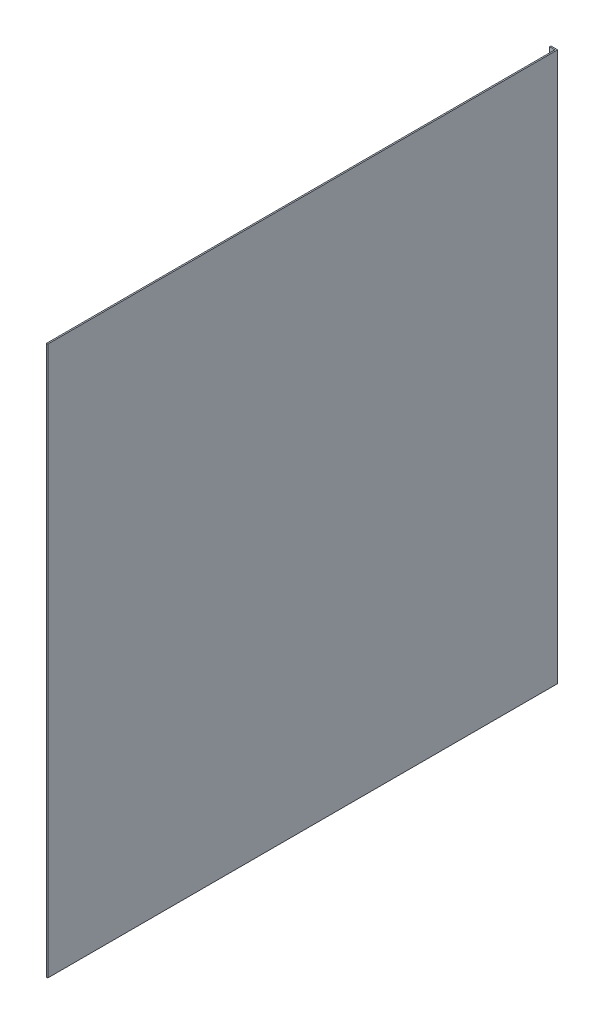
from build123d import *

# Parameters (mm, degrees)
PACK_SARJOR_L_KILAVUZ_2_1_START = 1040
PACK_SARJOR_L_KILAVUZ_2_1_DEPTH = 840


with BuildPart() as part:
    # Sketch1 → PACK_sarjor_L_kilavuz_2_1 (new body)
    with BuildSketch(Plane(origin=(0, 0, 0), x_dir=(1, 0, 0), z_dir=(0, 1, 0)).offset(PACK_SARJOR_L_KILAVUZ_2_1_START)):
        Polygon((560, 800), (550, 800), (550, 798), (558, 798), (558, 20), (560, 20), align=None)
    extrude(amount=PACK_SARJOR_L_KILAVUZ_2_1_DEPTH)


solid = part.part
